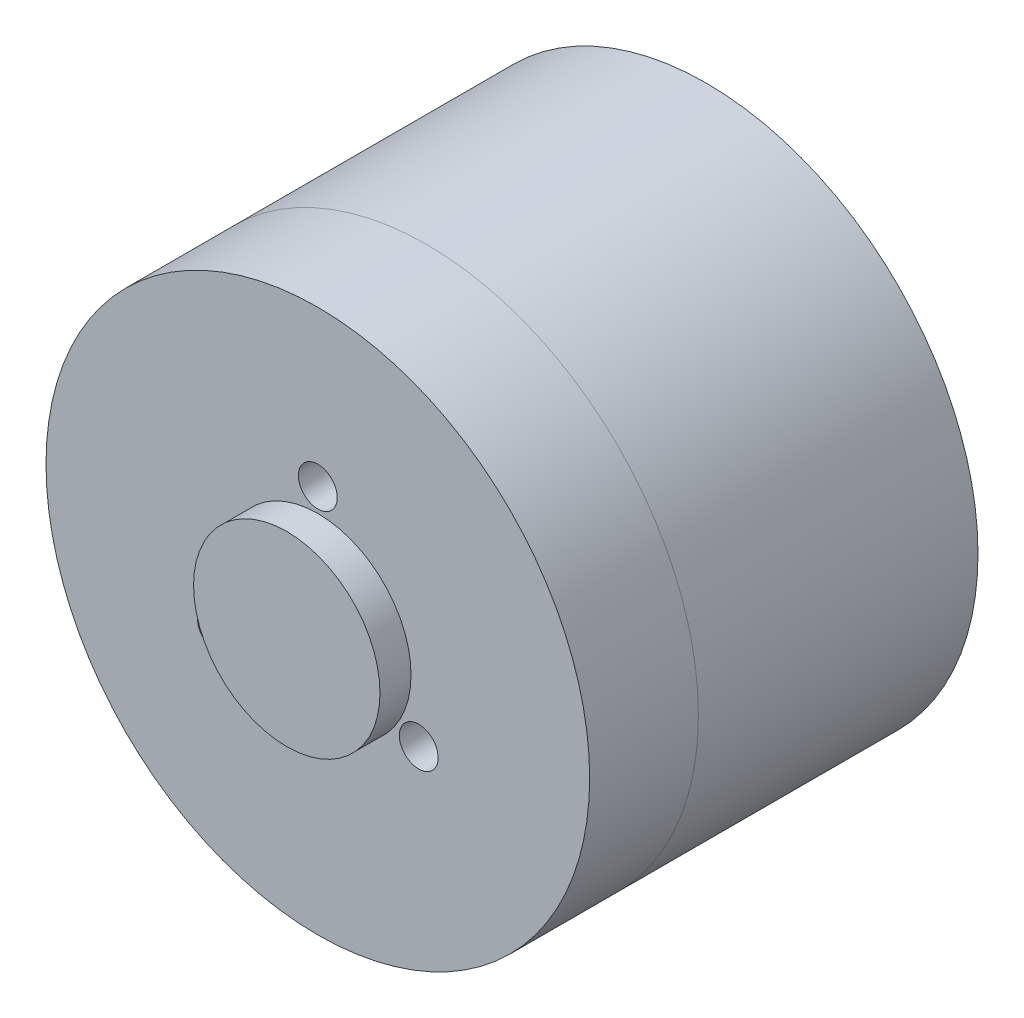
from build123d import *

# Parameters (mm, degrees)
SKETCH1_R           = 17.5
SKETCH1_R_2         = 1.25
BOSS_EXTRUDE1_DEPTH = 4
SKETCH2_R           = 17.5
SKETCH2_R_2         = 15
BOSS_EXTRUDE2_DEPTH = 3
SKETCH3_R           = 6
BOSS_EXTRUDE3_DEPTH = 2
SKETCH4_R           = 17.5
SKETCH4_R_2         = 15
BOSS_EXTRUDE4_DEPTH = 18


with BuildPart() as part:
    # Sketch1 → Boss-Extrude1 (new body)
    with BuildSketch(Plane.XY):
        Circle(SKETCH1_R)
        with Locations((0, 7.5)):
            Circle(SKETCH1_R_2, mode=Mode.SUBTRACT)
        with Locations((6.495190528, -3.75)):
            Circle(SKETCH1_R_2, mode=Mode.SUBTRACT)
        with Locations((-6.495190528, -3.75)):
            Circle(SKETCH1_R_2, mode=Mode.SUBTRACT)
    extrude(amount=-BOSS_EXTRUDE1_DEPTH)

    # Sketch2 → Boss-Extrude2 (add)
    with BuildSketch(Plane(origin=(0, 0, -4), x_dir=(-1, 0, 0), z_dir=(0, 0, -1))):
        with Locations(Location((0, 0, 0), (0, 0, 180))):
            Circle(SKETCH2_R)
        Circle(SKETCH2_R_2, mode=Mode.SUBTRACT)
    extrude(amount=BOSS_EXTRUDE2_DEPTH)

    # Sketch3 → Boss-Extrude3 (add)
    with BuildSketch(Plane.XY):
        Circle(SKETCH3_R)
    extrude(amount=BOSS_EXTRUDE3_DEPTH)


with BuildPart() as body_2:
    # Sketch4 → Boss-Extrude4 (new body)
    with BuildSketch(Plane(origin=(0, 0, -7), x_dir=(-1, 0, 0), z_dir=(0, 0, -1))):
        Circle(SKETCH4_R)
        Circle(SKETCH4_R_2, mode=Mode.SUBTRACT)
    extrude(amount=BOSS_EXTRUDE4_DEPTH)


solid = Compound([part.part, body_2.part])
